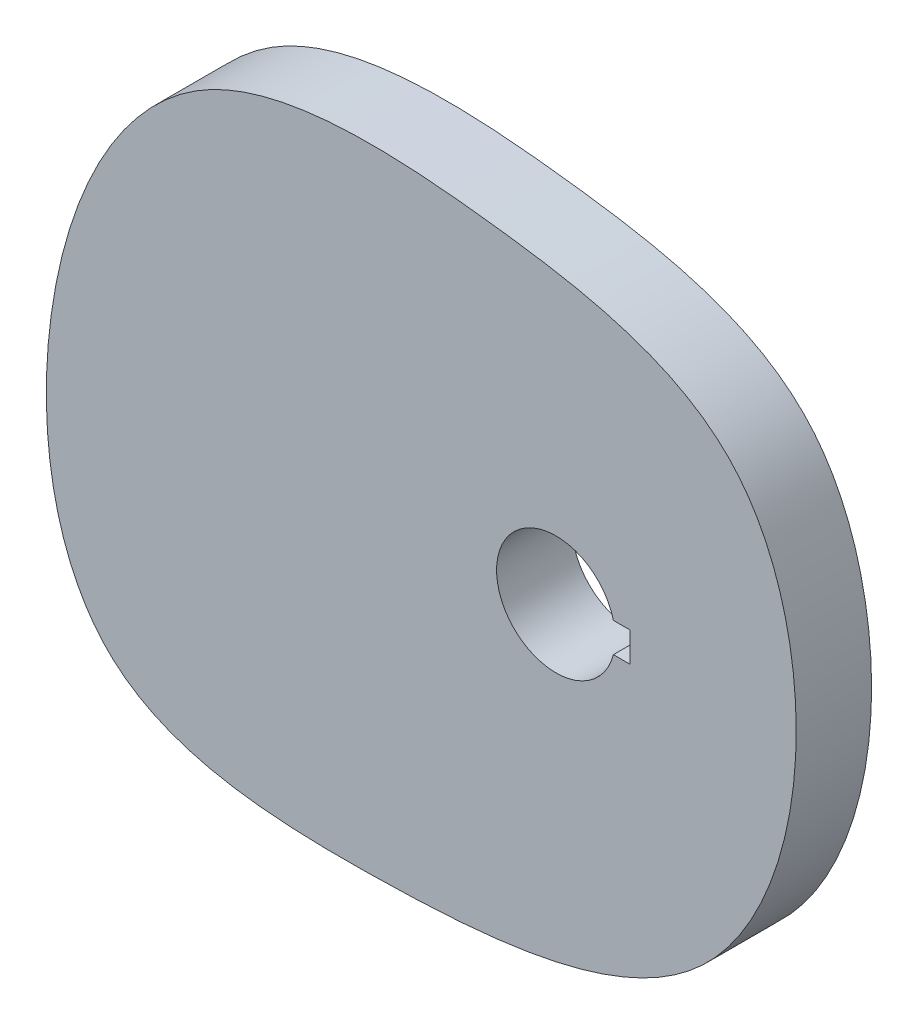
from build123d import *

# Parameters (mm, degrees)
EXTRUDE1_DEPTH = 12.7


with BuildPart() as part:
    # Sketch1 → Extrude1 (new, symmetric)
    with BuildSketch(Plane.XY):
        with BuildLine():
            add(Edge.make_bspline(
                [(80, 20), (77.715286296, 39.089043578), (61.381655956, 86.290713409), (-25.312200485, 103.207072369), (-130.731631299, 107.805639115), (-180.043630285, 6.70139491), (-165.34273118, -107.547641326), (-50.756482262, -112.601932318), (62.006419847, -101.040992339), (84.42941158, -17.008238941), (80, 20)],
                knots=[0, 0, 0, 0, 0.072229968, 0.186828712, 0.321625366, 0.459718269, 0.583377883, 0.707037498, 0.859966587, 1, 1, 1, 1], degree=3))
        make_face()
        with BuildLine():
            Line((19.364916731, 5), (25, 5))
            Line((25, 5), (25, -5))
            Line((25, -5), (19.364916731, -5))
            ThreePointArc((19.364916731, -5), (-20, 0), (19.364916731, 5))
        make_face(mode=Mode.SUBTRACT)
    extrude(amount=EXTRUDE1_DEPTH, both=True)


solid = part.part
